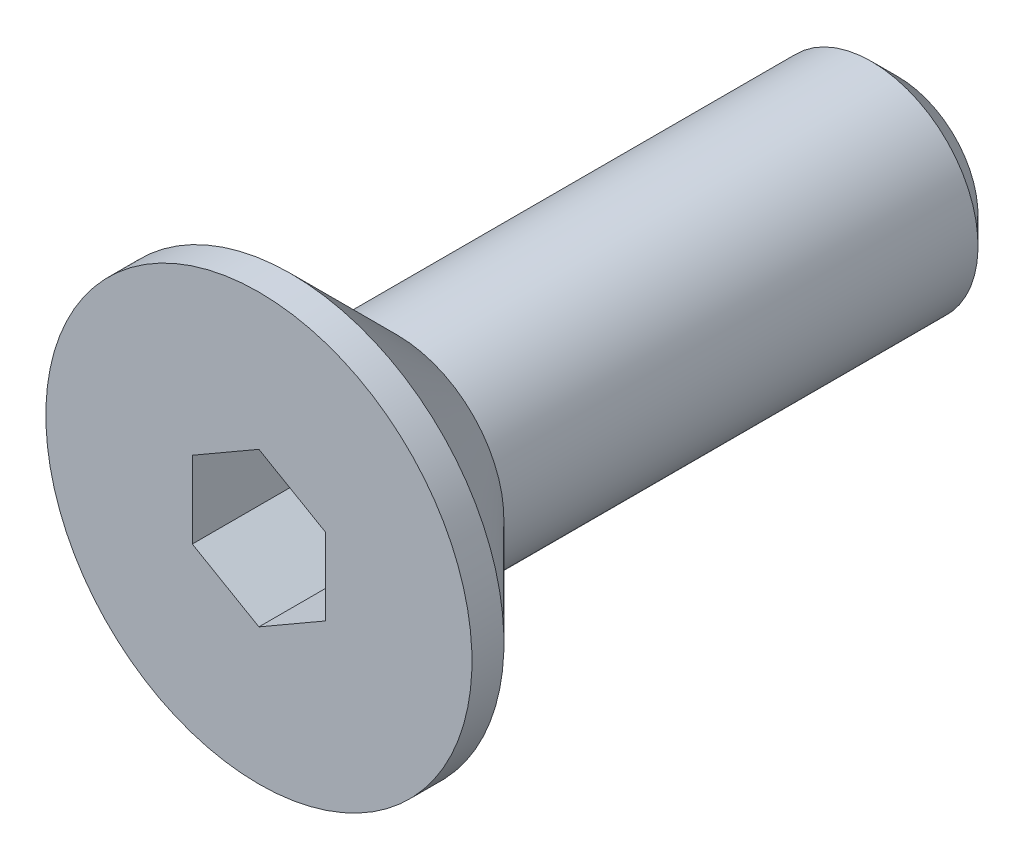
from build123d import *

# Parameters (mm, degrees)
CHAMFER_1_SIZE      = 0.5
CUT_EXTRUDE_1_DEPTH = 2.5


with BuildPart() as part:
    # 草图1 → 旋转1 (revolve)
    with BuildSketch(Plane(origin=(0, 0, 0), x_dir=(0, 0, -1), z_dir=(1, 0, 0))):
        Polygon((-6, 0), (-6, 4), (-5.4, 4), (-3.4, 2), (6, 2), (6, 0), align=None)
    revolve(axis=Axis((0, 0, -6), (0, 0, 1)))

    # 倒角1
    chamfer_1_edges = [part.edges().sort_by_distance(p)[0] for p in [
        (0, -2, -6),
    ]]
    chamfer(chamfer_1_edges, length=CHAMFER_1_SIZE)

    # 草图2 → 切除-拉伸1 (cut)
    with BuildSketch(Plane.XY.offset(6)):
        Polygon((0, 1.443375673), (-1.25, 0.721687836), (-1.25, -0.721687836), (0, -1.443375673), (1.25, -0.721687836), (1.25, 0.721687836), align=None)
    extrude(amount=-CUT_EXTRUDE_1_DEPTH, mode=Mode.SUBTRACT)


solid = part.part
